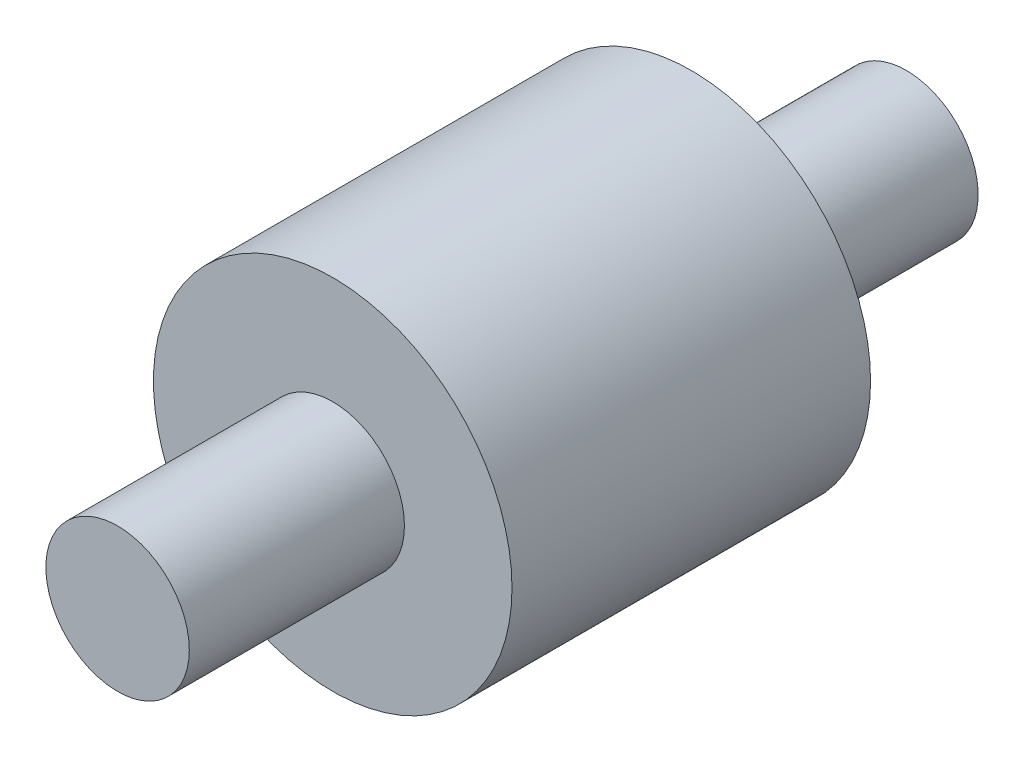
from build123d import *

# Parameters (mm, degrees)
SKETCH1_R           = 25
BOSS_EXTRUDE1_DEPTH = 25
SKETCH2_R           = 10
BOSS_EXTRUDE2_DEPTH = 30
BOSS_EXTRUDE3_START = 30
SKETCH3_R           = 10
BOSS_EXTRUDE3_DEPTH = 30


with BuildPart() as part:
    # Sketch1 → Boss-Extrude1 (new, symmetric)
    with BuildSketch(Plane.XY):
        Circle(SKETCH1_R)
    extrude(amount=BOSS_EXTRUDE1_DEPTH, both=True)

    # Sketch2 → Boss-Extrude2 (add)
    with BuildSketch(Plane(origin=(0, 0, -25), x_dir=(-1, 0, 0), z_dir=(0, 0, -1))):
        Circle(SKETCH2_R)
    extrude(amount=BOSS_EXTRUDE2_DEPTH)

    # Sketch3 → Boss-Extrude3 (add)
    with BuildSketch(Plane.XY.offset(25).offset(BOSS_EXTRUDE3_START)):
        with Locations(Location((0, 0, 0), (0, 0, 180))):
            Circle(SKETCH3_R)
    extrude(amount=-BOSS_EXTRUDE3_DEPTH)


solid = part.part
